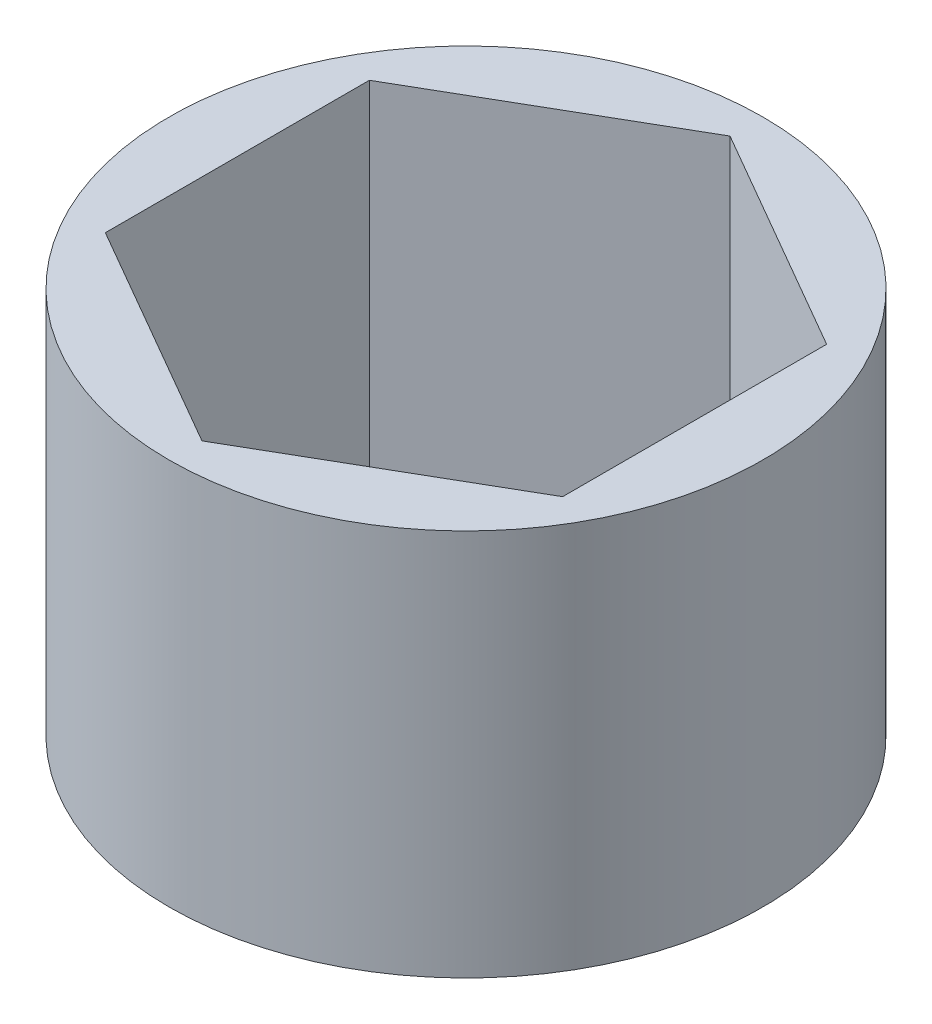
from build123d import *

# Parameters (mm, degrees)
SKETCH1_R           = 8.768816794
BOSS_EXTRUDE1_DEPTH = 11.43


with BuildPart() as part:
    # Sketch1 → Boss-Extrude1 (new body)
    with BuildSketch(Plane(origin=(0, 0, 0), x_dir=(1, 0, 0), z_dir=(0, 1, 0))):
        with Locations(Location((0, 0, 0), (0, 0, 270))):
            Circle(SKETCH1_R)
        Polygon((0, 7.794228634), (-6.75, 3.897114317), (-6.75, -3.897114317), (0, -7.794228634), (6.75, -3.897114317), (6.75, 3.897114317), align=None, mode=Mode.SUBTRACT)
    extrude(amount=BOSS_EXTRUDE1_DEPTH)


solid = part.part
